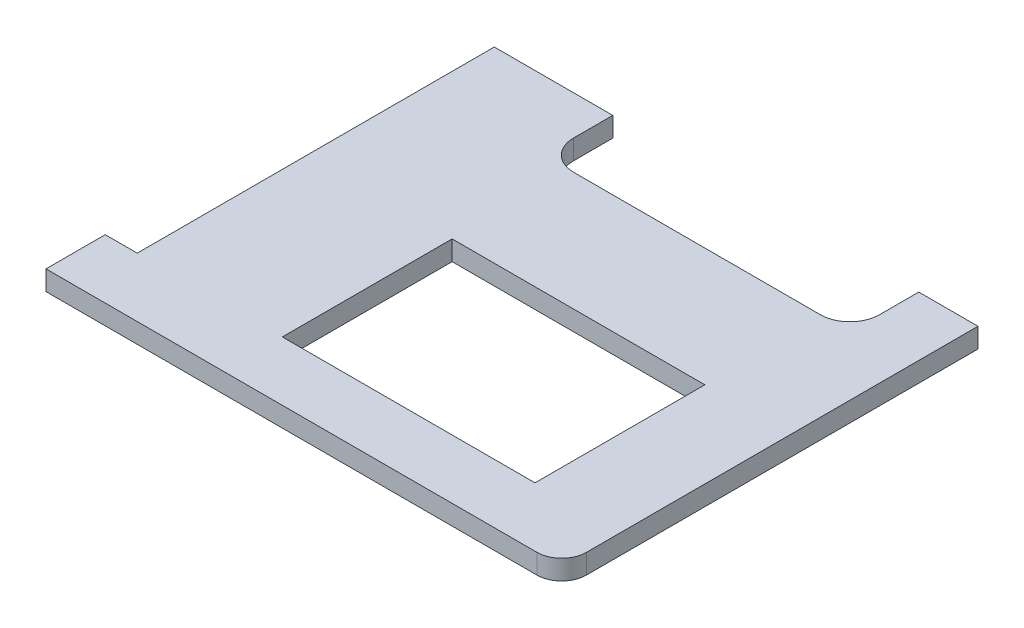
from build123d import *

# Parameters (mm, degrees)
BOSS_EXTRUDE1_DEPTH = 10
SKETCH3_W           = 128
SKETCH3_H           = 86
SKETCH3_W_2         = 66
SKETCH3_H_2         = 212
CUT_EXTRUDE1_DEPTH  = 345.796316686
CUT_EXTRUDE2_DEPTH  = 345.796316686
SKETCH6_W           = 343.5
SKETCH6_H           = 159.021787697
CUT_EXTRUDE3_DEPTH  = 345.796316686
SKETCH7_W           = 86.89559668
SKETCH7_H           = 224.425885746
CUT_EXTRUDE4_DEPTH  = 345.796316686


with BuildPart() as part:
    # Sketch4 → Boss-Extrude1 (new body)
    with BuildSketch(Plane(origin=(0, 0, 0), x_dir=(1, 0, 0), z_dir=(0, 1, 0))):
        with BuildLine():
            Line((-221, 107.5), (95, 107.5))
            ThreePointArc((95, 107.5), (103.838834765, 103.838834765), (107.5, 95))
            Line((107.5, 95), (107.5, -241))
            ThreePointArc((107.5, -241), (103.838834765, -249.838834765), (95, -253.5))
            Line((95, -253.5), (-221, -253.5))
            ThreePointArc((-221, -253.5), (-229.838834765, -249.838834765), (-233.5, -241))
            Line((-233.5, -241), (-233.5, 95))
            ThreePointArc((-233.5, 95), (-229.838834765, 103.838834765), (-221, 107.5))
        make_face()
    extrude(amount=BOSS_EXTRUDE1_DEPTH)

    # Sketch3 → Cut-Extrude1 (cut, through all)
    with BuildSketch(Plane(origin=(0, 0, 0), x_dir=(1, 0, 0), z_dir=(0, 1, 0))):
        with Locations((0, -180.5)):
            Rectangle(SKETCH3_W, SKETCH3_H)
        with Locations((-170.5, -117.5)):
            Rectangle(SKETCH3_W_2, SKETCH3_H_2)
    extrude(amount=CUT_EXTRUDE1_DEPTH, mode=Mode.SUBTRACT)

    # Sketch1 → Cut-Extrude2 (cut, through all)
    with BuildSketch(Plane(origin=(0, 0, 0), x_dir=(1, 0, 0), z_dir=(0, 1, 0))):
        with BuildLine():
            Line((-62.5, -77.5), (62.5, -77.5))
            ThreePointArc((62.5, -77.5), (73.106601718, -73.106601718), (77.5, -62.5))
            Line((77.5, -62.5), (77.5, 62.5))
            ThreePointArc((77.5, 62.5), (73.106601718, 73.106601718), (62.5, 77.5))
            Line((62.5, 77.5), (-62.5, 77.5))
            ThreePointArc((-62.5, 77.5), (-73.106601718, 73.106601718), (-77.5, 62.5))
            Line((-77.5, 62.5), (-77.5, -62.5))
            ThreePointArc((-77.5, -62.5), (-73.106601718, -73.106601718), (-62.5, -77.5))
        make_face()
    extrude(amount=CUT_EXTRUDE2_DEPTH, mode=Mode.SUBTRACT)

    # Sketch6 → Cut-Extrude3 (cut, through all)
    with BuildSketch(Plane(origin=(0, 0, 0), x_dir=(1, 0, 0), z_dir=(0, 1, 0))):
        with Locations((-61.75, 36.875290319)):
            Rectangle(SKETCH6_W, SKETCH6_H)
    extrude(amount=CUT_EXTRUDE3_DEPTH, mode=Mode.SUBTRACT)

    # Sketch7 → Cut-Extrude4 (cut, through all)
    with BuildSketch(Plane(origin=(0, 0, 0), x_dir=(1, 0, 0), z_dir=(0, 1, 0))):
        with Locations((-197.154605401, -141.287057127)):
            Rectangle(SKETCH7_W, SKETCH7_H)
    extrude(amount=CUT_EXTRUDE4_DEPTH, mode=Mode.SUBTRACT)


solid = part.part
